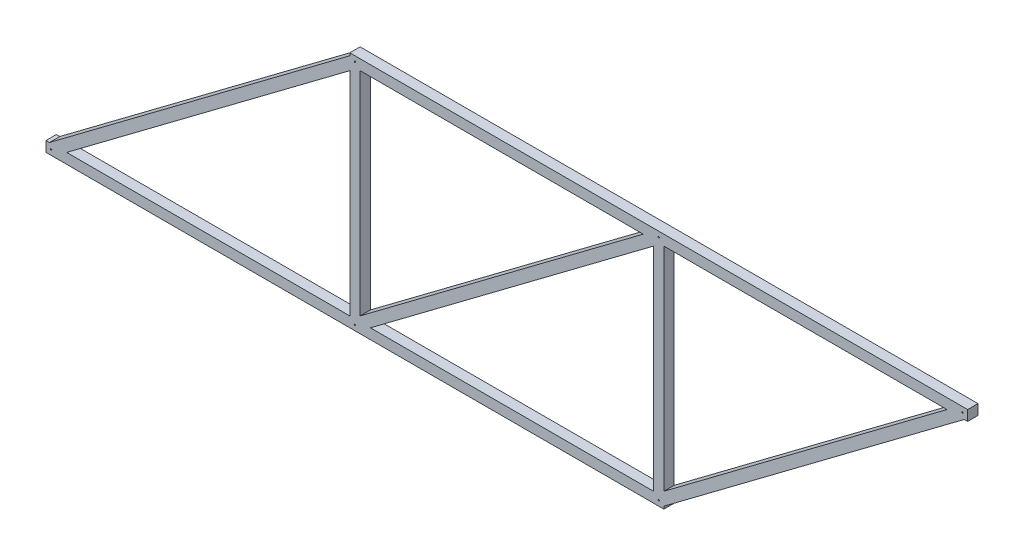
from build123d import *

# Parameters (mm, degrees)
SKETCH2_R           = 0.85
BOSS_EXTRUDE1_DEPTH = 13.6


with BuildPart() as part:
    # Sketch2 → Boss-Extrude1 (new body)
    with BuildSketch(Plane.XY):
        Polygon((400, 0), (-400, 0), (-406.8, 0), (-406.8, 13.6), (-402.266666667, 13.6), (-306.362355233, 85.528233586), (-6.8, 310.200000045), (-6.8, 313.6), (0, 313.6), (800, 313.6), (806.8, 313.6), (806.8, 300), (802.266666606, 300), (406.8, 3.4), (406.8, 0), align=None)
        with Locations((0.107289977, 306.8)):
            Circle(SKETCH2_R, mode=Mode.SUBTRACT)
        with Locations((-399.99999994, 6.8)):
            Circle(SKETCH2_R, mode=Mode.SUBTRACT)
        with Locations((0, 6.8)):
            Circle(SKETCH2_R, mode=Mode.SUBTRACT)
        with Locations((400, 6.8)):
            Circle(SKETCH2_R, mode=Mode.SUBTRACT)
        with Locations((800, 306.8)):
            Circle(SKETCH2_R, mode=Mode.SUBTRACT)
        with Locations((400, 306.8)):
            Circle(SKETCH2_R, mode=Mode.SUBTRACT)
        Polygon((-6.8, 13.6), (-6.8, 293.200000044), (-298.202355233, 74.648233587), (-379.600000002, 13.6), align=None, mode=Mode.SUBTRACT)
        Polygon((6.8, 300), (6.8, 20.4), (106.280361955, 95.010271466), (379.6, 300), align=None, mode=Mode.SUBTRACT)
        Polygon((393.2, 13.6), (393.2, 293.2), (114.440361955, 84.130271466), (20.4, 13.6), align=None, mode=Mode.SUBTRACT)
        Polygon((406.8, 20.400000001), (406.8, 300), (779.599999942, 300), align=None, mode=Mode.SUBTRACT)
    extrude(amount=BOSS_EXTRUDE1_DEPTH)


solid = part.part
